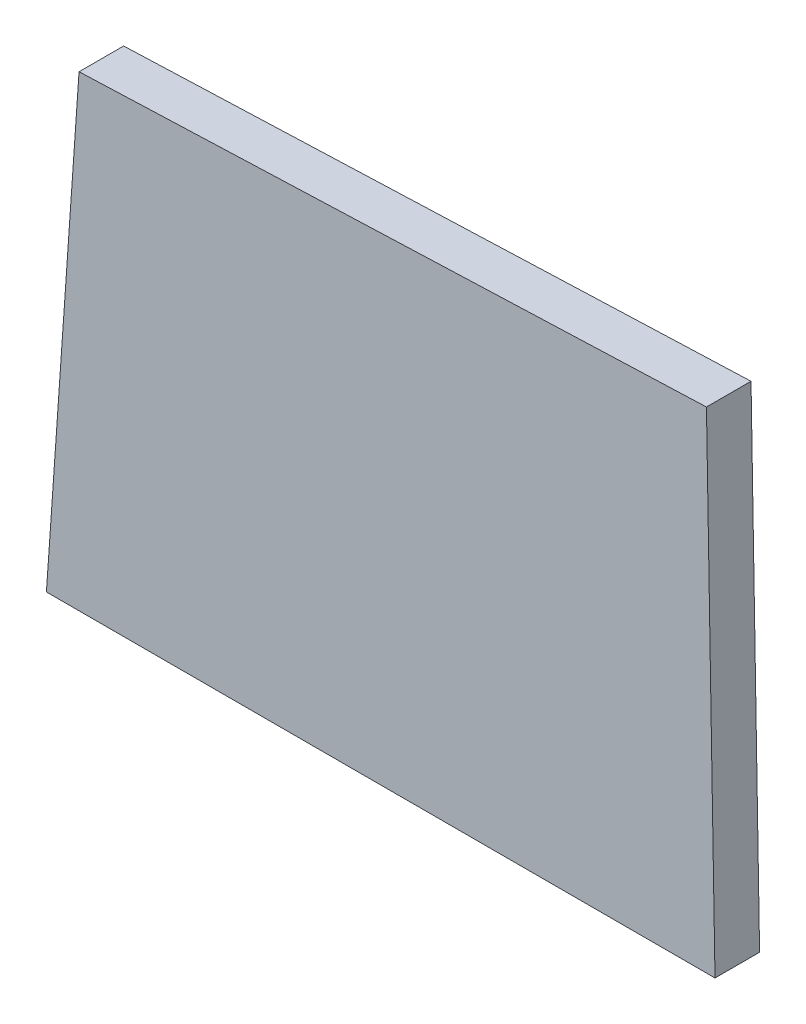
from build123d import *

# Parameters (mm, degrees)
AUFSATZ_LINEAR_AUSTRAGEN1_DEPTH = 2


with BuildPart() as part:
    # Skizze1 → Aufsatz-Linear austragen1 (new body)
    with BuildSketch(Plane.XY):
        Polygon((0, 0), (1.464885949, 20.948845055), (29.616047058, 21.996649293), (30, 0), align=None)
    extrude(amount=AUFSATZ_LINEAR_AUSTRAGEN1_DEPTH)


solid = part.part
